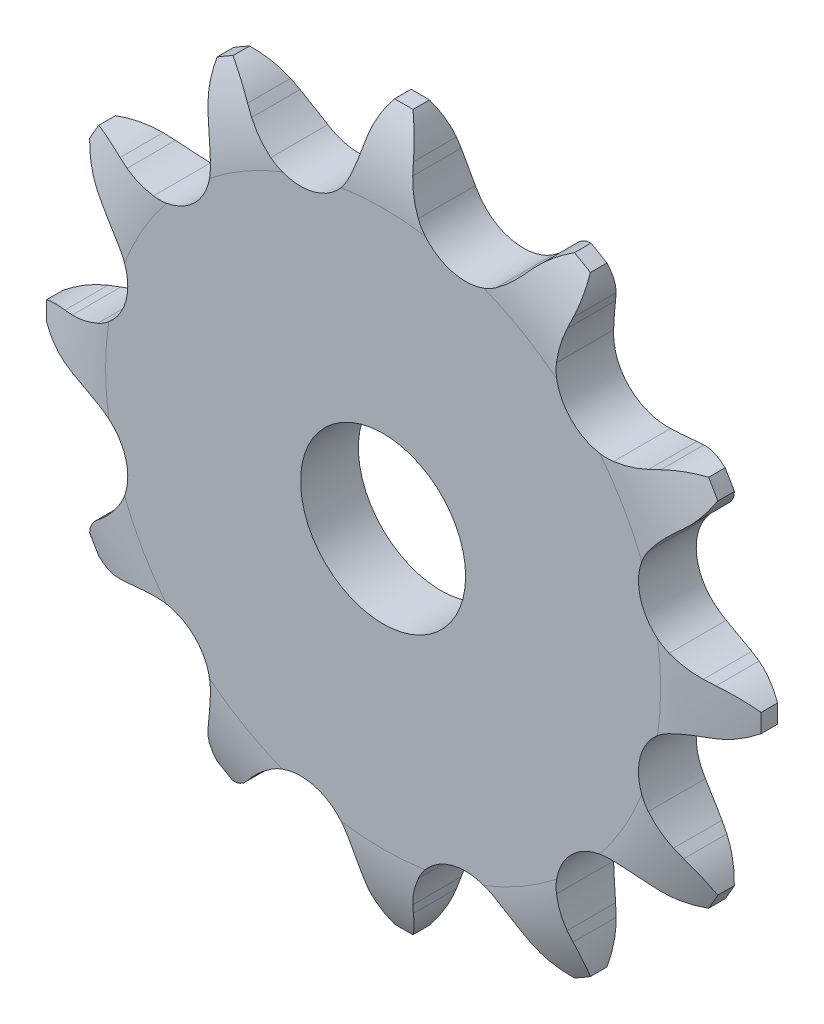
from build123d import *

# Parameters (mm, degrees)
CUT_EXTRUDE1_DEPTH      = 25.545738008
CIRPATTERN1_COUNT       = 12
BOSS_EXTRUDE1_START     = 1.4
SKETCH2_R               = 10
BOSS_EXTRUDE1_DEPTH     = 10.2
CUT_EXTRUDE2_DEPTH      = 28.112603367
CUT_EXTRUDE2_DEPTH_BACK = 28.112603367
SKETCH3_R               = 4
SKETCH4_W               = 2.1
SKETCH4_H               = 7.173390009
SKETCH6_R               = 10
CUT_EXTRUDE4_DEPTH      = 20


with BuildPart() as part:
    # Sketch1 → Revolve1 (revolve)
    with BuildSketch(Plane(origin=(0, 0, 0), x_dir=(0, 0, -1), z_dir=(1, 0, 0))):
        with BuildLine():
            Line((1.4, 0), (-1.4, 0))
            Line((-1.4, 0), (-1.4, 13.455219884))
            ThreePointArc((-1.4, 13.455219884), (-1.145966692, 15.455219884), (-0.4, 17.32820323))
            Line((-0.4, 17.32820323), (0.4, 17.32820323))
            ThreePointArc((0.4, 17.32820323), (1.145966692, 15.455219884), (1.4, 13.455219884))
            Line((1.4, 13.455219884), (1.4, 0))
        make_face()
    revolve(axis=Axis((0, 0, -1.4), (0, 0, 1)))

    # Sketch0 → Cut-Extrude1 (cut, symmetric)
    with BuildSketch(Plane.XY):
        with BuildLine():
            Line((6.926940619, -14.218327436), (6.599156686, -13.84999961))
            ThreePointArc((6.599156686, -13.84999961), (6.060506052, -13.311348976), (5.462964059, -12.838874026))
            ThreePointArc((5.462964059, -12.838874026), (3.339856144, -12.464512818), (1.688371358, -13.850273092))
            ThreePointArc((1.688371358, -13.850273092), (1.407122287, -14.558219398), (1.209962471, -15.294029848))
            Line((1.209962471, -15.294029848), (1.110257171, -15.776903068))
            ThreePointArc((1.110257171, -15.776903068), (-0.68444399, -18.428589751), (-3.826897653, -19.042901968))
            ThreePointArc((-3.826897653, -19.042901968), (5.027204427, -18.761782342), (12.835641569, -14.57818804))
            ThreePointArc((12.835641569, -14.57818804), (9.807040758, -15.617404885), (6.926940619, -14.218327436))
        make_face()
    cut_extrude1 = extrude(amount=CUT_EXTRUDE1_DEPTH, both=True, mode=Mode.SUBTRACT)

    # CirPattern1: Cut-Extrude1 ×12 about axis
    cirpattern1_axis = Axis((0, 0, 0), (0, 0, 1))
    for i in range(1, CIRPATTERN1_COUNT):
        add(cut_extrude1.rotate(cirpattern1_axis, i * 360 / CIRPATTERN1_COUNT), mode=Mode.SUBTRACT)

    # Sketch2 → Boss-Extrude1 (add)
    with BuildSketch(Plane.XY.offset(BOSS_EXTRUDE1_START)):
        with Locations(Location((0, 0, 0), (0, 0, 270))):
            Circle(SKETCH2_R)
    extrude(amount=BOSS_EXTRUDE1_DEPTH)

    # Sketch3 → Cut-Extrude2 (cut, two sides: drawn at the far end of the back side and taken through both)
    with BuildSketch(Plane.XY.offset(-CUT_EXTRUDE2_DEPTH_BACK)):
        Circle(SKETCH3_R)
    extrude(amount=CUT_EXTRUDE2_DEPTH + CUT_EXTRUDE2_DEPTH_BACK, mode=Mode.SUBTRACT)

    # Sketch4 → Cut-Revolve1 (revolve, cut)
    with BuildSketch(Plane(origin=(0, 0, 0), x_dir=(0, 0, -1), z_dir=(1, 0, 0))):
        Polygon((-11.6, 10), (-11.6, 9.5), (-11.1, 10), align=None)
        with Locations((-2.45, 13.741508226)):
            Rectangle(SKETCH4_W, SKETCH4_H)
    revolve(axis=Axis((0, 0, -1.4), (0, 0, 1)), mode=Mode.SUBTRACT)

    # Sketch6 → Cut-Extrude4 (cut)
    with BuildSketch(Plane.XY.offset(1.4)):
        Circle(SKETCH6_R)
    extrude(amount=CUT_EXTRUDE4_DEPTH, mode=Mode.SUBTRACT)


solid = part.part
